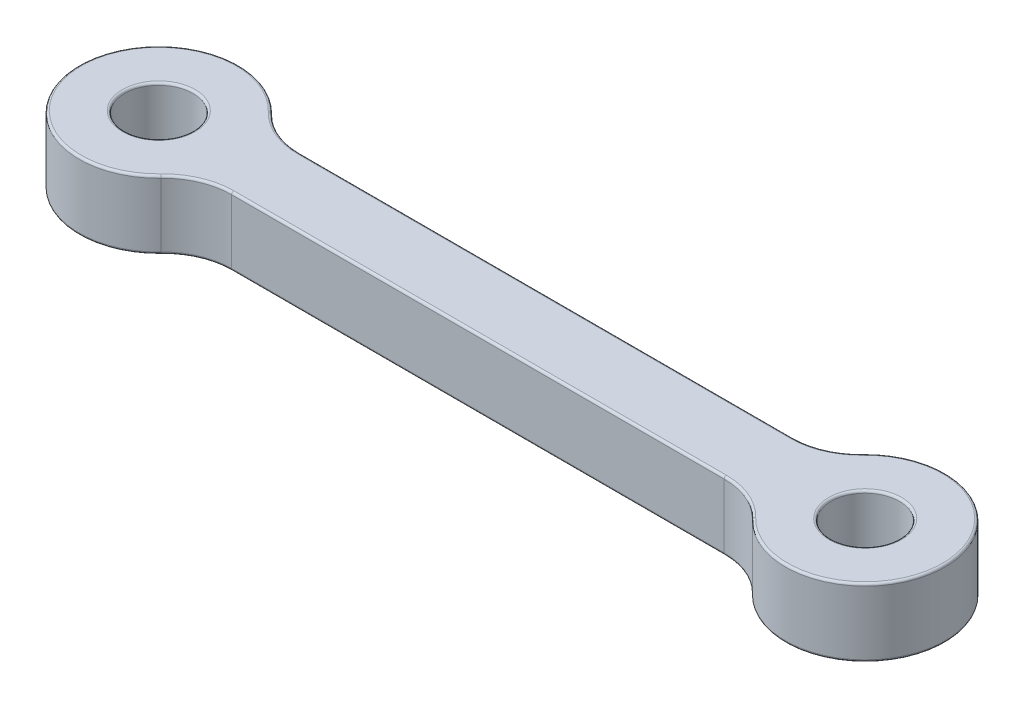
from build123d import *

# Parameters (mm, degrees)
SKETCH1_R           = 1.5
BOSS_EXTRUDE1_DEPTH = 3
FILLET1_R           = 0.1


with BuildPart() as part:
    # Sketch1 → Boss-Extrude1 (new body)
    with BuildSketch(Plane(origin=(0, 0, 0), x_dir=(1, 0, 0), z_dir=(0, 1, 0))):
        with BuildLine():
            Line((4.69041576, 1.5), (26.30958424, 1.5))
            ThreePointArc((26.30958424, 1.5), (27.486281051, 1.740401367), (28.474391514, 2.423076923))
            ThreePointArc((28.474391514, 2.423076923), (34.5, 0), (28.474391514, -2.423076923))
            ThreePointArc((28.474391514, -2.423076923), (27.486281051, -1.740401367), (26.30958424, -1.5))
            Line((26.30958424, -1.5), (4.69041576, -1.5))
            ThreePointArc((4.69041576, -1.5), (3.513718949, -1.740401367), (2.525608486, -2.423076923))
            ThreePointArc((2.525608486, -2.423076923), (-3.5, 0), (2.525608486, 2.423076923))
            ThreePointArc((2.525608486, 2.423076923), (3.513718949, 1.740401367), (4.69041576, 1.5))
        make_face()
        with Locations(Location((0, 0, 0), (0, 0, 270))):
            Circle(SKETCH1_R, mode=Mode.SUBTRACT)
        with Locations(Location((31, 0, 0), (0, 0, 270))):
            Circle(SKETCH1_R, mode=Mode.SUBTRACT)
    extrude(amount=BOSS_EXTRUDE1_DEPTH)

    # Fillet1
    fillet1_edges = [part.edges().sort_by_distance(p)[0] for p in [
        (27.486281051, 0, -1.740401367),
        (34.5, 0, 0),
        (31, 3, -1.5),
        (27.486281051, 0, 1.740401367),
        (15.5, 0, 1.5),
        (3.513718949, 0, 1.740401367),
        (-3.5, 0, 0),
        (3.513718949, 0, -1.740401367),
        (15.5, 0, -1.5),
        (31, 0, -1.5),
        (0, 0, -1.5),
        (15.5, 3, -1.5),
        (3.513718949, 3, -1.740401367),
        (-3.5, 3, 0),
        (3.513718949, 3, 1.740401367),
        (15.5, 3, 1.5),
        (27.486281051, 3, 1.740401367),
        (34.5, 3, 0),
        (27.486281051, 3, -1.740401367),
        (0, 3, -1.5),
    ]]
    fillet(fillet1_edges, radius=FILLET1_R)


solid = part.part
